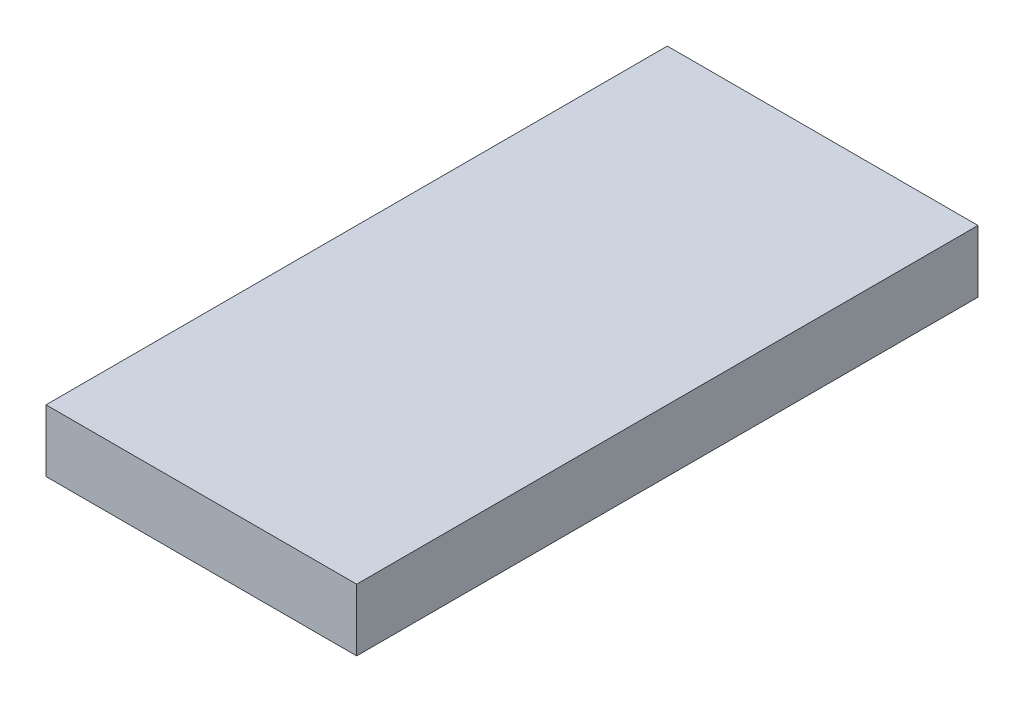
from build123d import *

# Parameters (mm, degrees)
CROQUIS1_W              = 60
CROQUIS1_H              = 120
SALIENTE_EXTRUIR1_DEPTH = 12


with BuildPart() as part:
    # Croquis1 → Saliente-Extruir1 (new body)
    with BuildSketch(Plane(origin=(0, 0, 0), x_dir=(1, 0, 0), z_dir=(0, 1, 0))):
        Rectangle(CROQUIS1_W, CROQUIS1_H)
    extrude(amount=SALIENTE_EXTRUIR1_DEPTH)


solid = part.part
